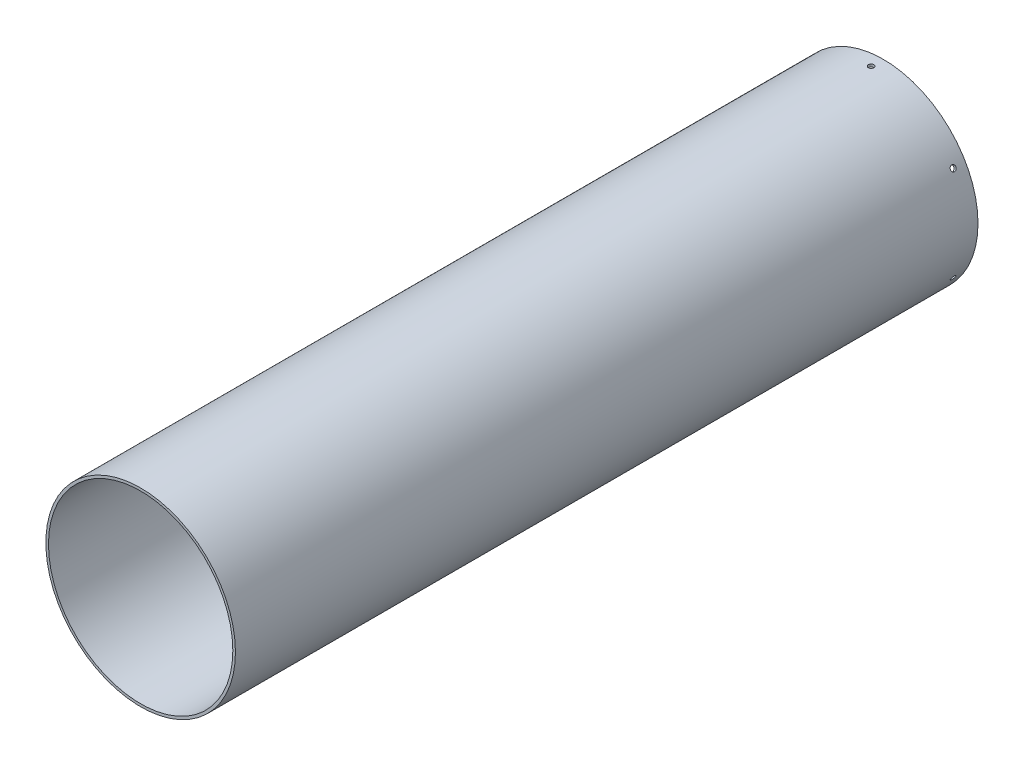
from build123d import *

# Parameters (mm, degrees)
SKETCH1_R           = 78.359
SKETCH1_R_2         = 76.2
BOSS_EXTRUDE1_DEPTH = 613.8
SKETCH5_W           = 2.25
SKETCH5_H           = 78.359
CIRPATTERN2_COUNT   = 6


with BuildPart() as part:
    # Sketch1 → Boss-Extrude1 (new body)
    with BuildSketch(Plane.XY):
        Circle(SKETCH1_R)
        Circle(SKETCH1_R_2, mode=Mode.SUBTRACT)
    extrude(amount=BOSS_EXTRUDE1_DEPTH)

    # Sketch5 → M4 Clearance Hole2 (revolve, cut)
    with BuildSketch(Plane(origin=(0, 0, 10), x_dir=(0, 0, -1), z_dir=(1, 0, 0))):
        with Locations((1.125, 39.1795)):
            Rectangle(SKETCH5_W, SKETCH5_H)
    m4_clearance_hole2 = revolve(axis=Axis((0, -6.35, 10), (0, 1, 0)), mode=Mode.SUBTRACT)

    # CirPattern2: M4 Clearance Hole2 ×6 about axis
    cirpattern2_axis = Axis((0, 0, 613.8), (0, 0, -1))
    for i in range(1, CIRPATTERN2_COUNT):
        add(m4_clearance_hole2.rotate(cirpattern2_axis, i * 360 / CIRPATTERN2_COUNT), mode=Mode.SUBTRACT)


solid = part.part
